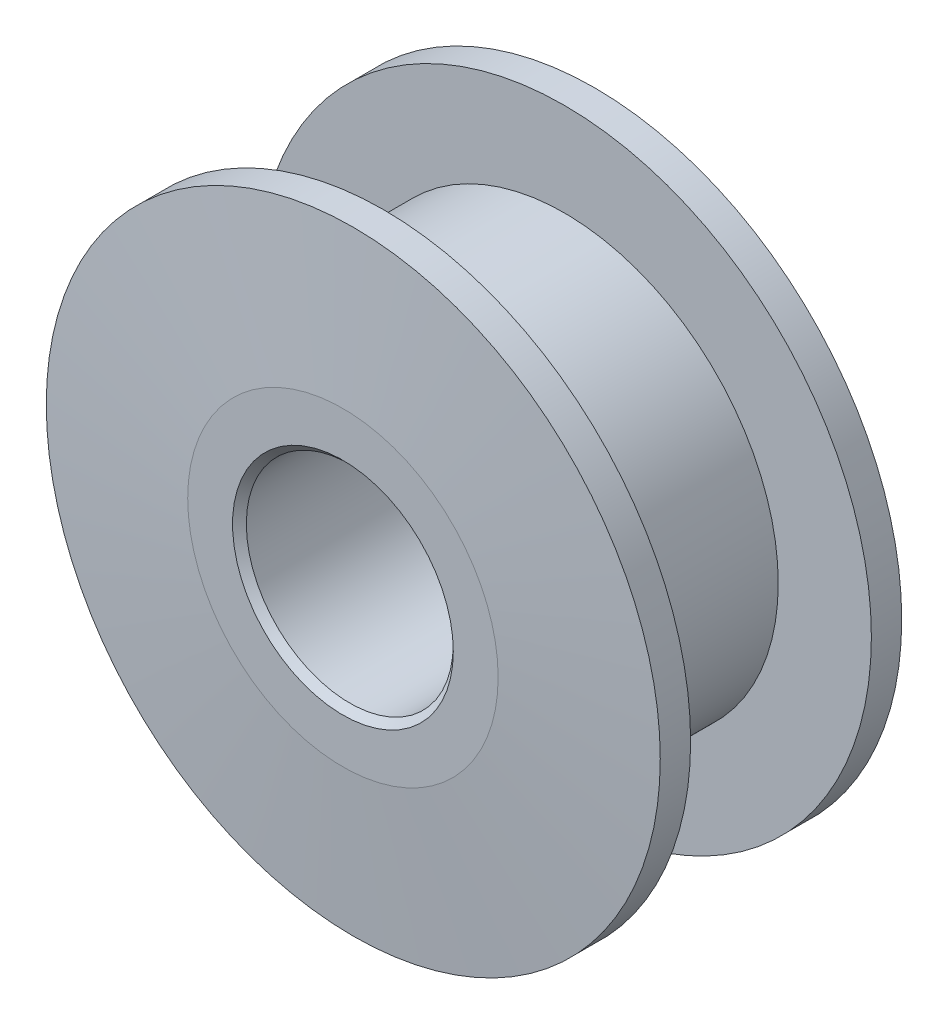
from build123d import *

# Parameters (mm, degrees)
SKETCH_1_R          = 4.45
EXTRUDE_1_DEPTH     = 1.9
SKETCH_2_R          = 4.45
SKETCH_2_R_2        = 3.1
CUT_EXTRUDE_2_DEPTH = 1.31
SKETCH_3_R          = 1
CUT_EXTRUDE_3_DEPTH = 3.8
CHAMFER_1_SIZE      = 0.25
CHAMFER_2_SIZE      = 2
CHAMFER_2_SIZE2     = 0.15
CHAMFER_3_SIZE      = 0.15
CHAMFER_3_SIZE2     = 2.2
SKETCH_4_R          = 1.5
CUT_EXTRUDE_1_DEPTH = 10
CHAMFER_4_SIZE      = 0.1


with BuildPart() as part:
    # 草图1 → 拉伸1 (new, symmetric)
    with BuildSketch(Plane.XY):
        with Locations(Location((0, 0, 0), (0, 0, 180))):
            Circle(SKETCH_1_R)
    extrude(amount=EXTRUDE_1_DEPTH, both=True)

    # 草图2 → 拉伸2 (cut, symmetric)
    with BuildSketch(Plane.XY):
        with Locations(Location((0, 0, 0), (0, 0, 180))):
            Circle(SKETCH_2_R)
        Circle(SKETCH_2_R_2, mode=Mode.SUBTRACT)
    extrude(amount=CUT_EXTRUDE_2_DEPTH, both=True, mode=Mode.SUBTRACT)

    # 草图3 → 拉伸3 (cut)
    with BuildSketch(Plane.XY.offset(1.9)):
        Circle(SKETCH_3_R)
    extrude(amount=-CUT_EXTRUDE_3_DEPTH, mode=Mode.SUBTRACT)

    # 倒角1
    chamfer_1_edges = [part.edges().sort_by_distance(p)[0] for p in [
        (-1, 0, 1.9),
        (-1, 0, -1.9),
    ]]
    chamfer(chamfer_1_edges, length=CHAMFER_1_SIZE)

    # 倒角2
    chamfer_2_edges = [part.edges().sort_by_distance(p)[0] for p in [
        (4.45, 0, -1.9),
    ]]
    chamfer_2_side = [part.faces().sort_by_distance(p)[0] for p in [
        (-1.375865007, 0, -1.9),
    ]]
    chamfer(chamfer_2_edges, length=CHAMFER_2_SIZE, length2=CHAMFER_2_SIZE2, reference=chamfer_2_side[0])

    # 倒角3
    chamfer_3_edges = [part.edges().sort_by_distance(p)[0] for p in [
        (4.45, 0, 1.9),
    ]]
    chamfer_3_side = [part.faces().sort_by_distance(p)[0] for p in [
        (4.45, 0, 1.605),
    ]]
    chamfer(chamfer_3_edges, length=CHAMFER_3_SIZE, length2=CHAMFER_3_SIZE2, reference=chamfer_3_side[0])

    # 草图4 → 切除-拉伸1 (cut)
    with BuildSketch(Plane(origin=(0, 0, -1.9), x_dir=(-1, 0, 0), z_dir=(0, 0, -1))):
        Circle(SKETCH_4_R)
    extrude(amount=-CUT_EXTRUDE_1_DEPTH, mode=Mode.SUBTRACT)

    # 倒角4
    chamfer_4_edges = [part.edges().sort_by_distance(p)[0] for p in [
        (1.5, 0, 1.9),
        (1.5, 0, -1.9),
    ]]
    chamfer(chamfer_4_edges, length=CHAMFER_4_SIZE)


solid = part.part
